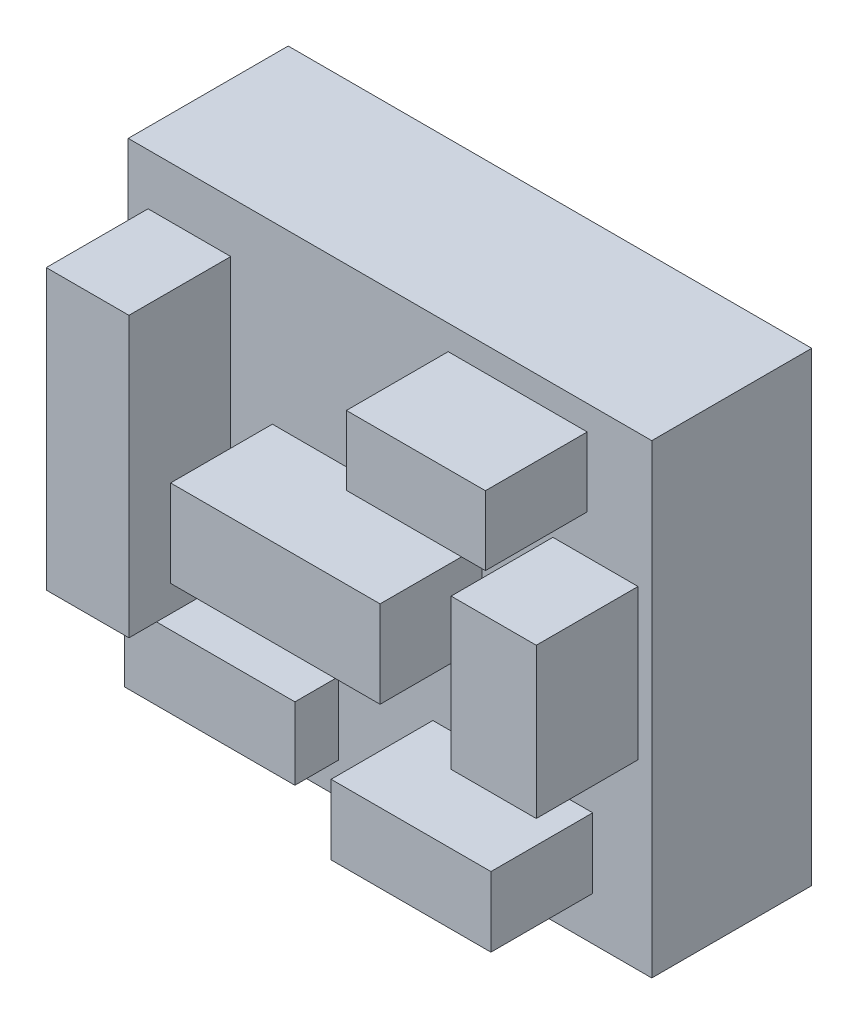
from build123d import *

# Parameters (mm, degrees)
SKETCH1_W           = 45.72
SKETCH1_H           = 40.64
BOSS_EXTRUDE1_DEPTH = 13.97
SKETCH2_W           = 7.220890655
SKETCH2_H           = 24.390563991
SKETCH2_W_2         = 12.141793916
SKETCH2_H_2         = 6.044152918
SKETCH2_W_3         = 7.434842971
SKETCH2_H_3         = 13.104579336
SKETCH2_W_4         = 13.960388599
SKETCH2_H_4         = 6.097640998
BOSS_EXTRUDE2_DEPTH = 8.89
SKETCH3_W           = 18.292922993
SKETCH3_H           = 7.595307208
BOSS_EXTRUDE3_DEPTH = 8.89
SKETCH4_W           = 14.869685941
SKETCH4_H           = 6.311593313
BOSS_EXTRUDE4_DEPTH = 3.81


with BuildPart() as part:
    # Sketch1 → Boss-Extrude1 (new body)
    with BuildSketch(Plane.XY):
        Rectangle(SKETCH1_W, SKETCH1_H)
    extrude(amount=BOSS_EXTRUDE1_DEPTH)

    # Sketch2 → Boss-Extrude2 (add)
    with BuildSketch(Plane.XY.offset(13.97)):
        with Locations((-17.517345848, 3.663933406)):
            Rectangle(SKETCH2_W, SKETCH2_H)
        with Locations((11.152264456, 15.137126336)):
            Rectangle(SKETCH2_W_2, SKETCH2_H_2)
        with Locations((17.94525048, 2.139523157)):
            Rectangle(SKETCH2_W_3, SKETCH2_H_3)
        with Locations((10.724359825, -13.45225185)):
            Rectangle(SKETCH2_W_4, SKETCH2_H_4)
    extrude(amount=BOSS_EXTRUDE2_DEPTH)

    # Sketch3 → Boss-Extrude3 (add)
    with BuildSketch(Plane.XY.offset(13.97)):
        with Locations((-1.123249658, 1.203481776)):
            Rectangle(SKETCH3_W, SKETCH3_H)
    extrude(amount=BOSS_EXTRUDE3_DEPTH)

    # Sketch4 → Boss-Extrude4 (add)
    with BuildSketch(Plane.XY.offset(13.97)):
        with Locations((-11.927841601, -14.361549191)):
            Rectangle(SKETCH4_W, SKETCH4_H)
    extrude(amount=BOSS_EXTRUDE4_DEPTH)


solid = part.part
